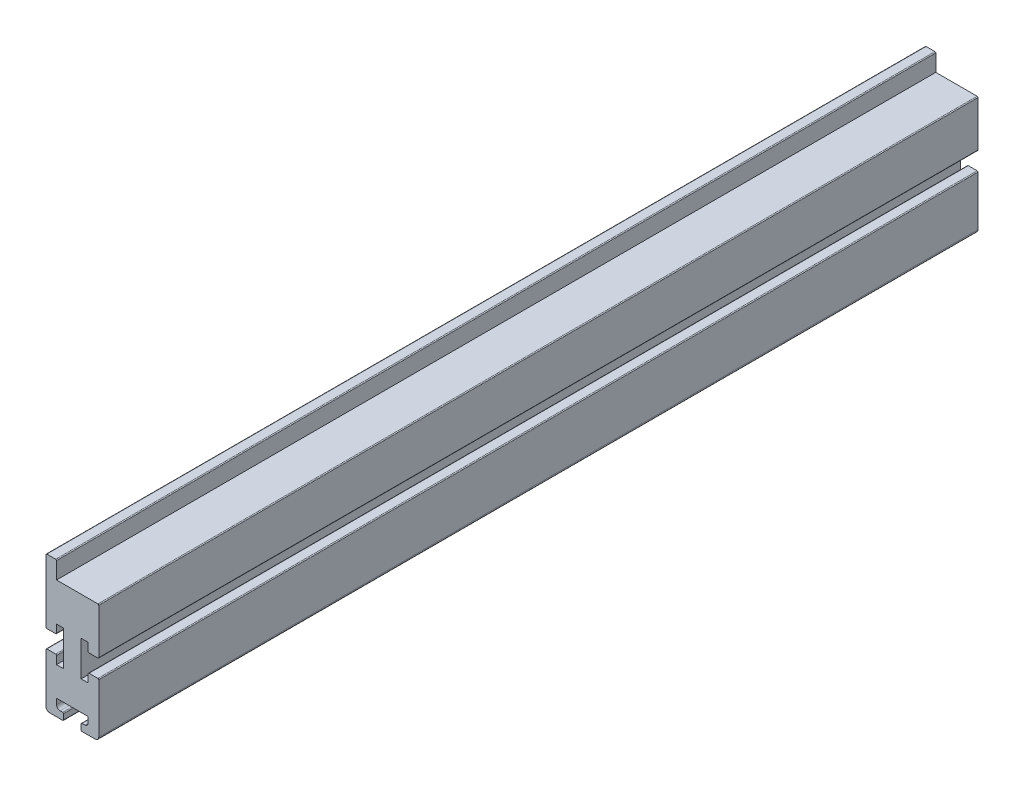
from build123d import *

# Parameters (mm, degrees)
SALIENTE_EXTRUIR1_DEPTH = 500
REDONDEO1_R             = 2
REDONDEO2_R             = 2
REDONDEO4_R             = 0.5


with BuildPart() as part:
    # Croquis1 → Saliente-Extruir1 (new body)
    with BuildSketch(Plane.XY):
        Polygon((-4.451940983, 8.315120378), (1.548059017, 8.315120378), (1.548059017, 13.315120378), (5.548059017, 13.315120378), (5.548059017, -6.684879622), (1.548059017, -6.684879622), (1.548059017, -1.684879622), (-4.451940983, -1.684879622), (-4.451940983, -32.384879622), (5.548059017, -32.384879622), (5.548059017, -28.384879622), (1.548059017, -28.384879622), (1.548059017, -23.250181803), (19.548059017, -23.250181803), (19.548059017, -28.384879622), (15.548059017, -28.384879622), (15.548059017, -32.384879622), (25.548059017, -32.384879622), (25.548059017, -1.684879622), (19.548059017, -1.684879622), (19.548059017, -6.684879622), (15.548059017, -6.684879622), (15.548059017, 13.315120378), (19.548059017, 13.315120378), (19.548059017, 8.315120378), (25.548059017, 8.315120378), (25.548059017, 35.015120378), (1.548059017, 35.015120378), (1.548059017, 45.015120378), (-4.451940983, 45.015120378), align=None)
    extrude(amount=SALIENTE_EXTRUIR1_DEPTH)

    # Redondeo1
    redondeo1_edges = [part.edges().sort_by_distance(p)[0] for p in [
        (25.548059017, -32.384879622, 250),
        (-4.451940983, -32.384879622, 250),
    ]]
    fillet(redondeo1_edges, radius=REDONDEO1_R)

    # Redondeo2
    redondeo2_edges = [part.edges().sort_by_distance(p)[0] for p in [
        (19.548059017, -28.384879622, 250),
        (1.548059017, -28.384879622, 250),
    ]]
    fillet(redondeo2_edges, radius=REDONDEO2_R)

    # Redondeo4
    redondeo4_edges = [part.edges().sort_by_distance(p)[0] for p in [
        (19.548059017, -1.684879622, 250),
        (25.548059017, -1.684879622, 250),
        (15.548059017, -32.384879622, 250),
        (15.548059017, -28.384879622, 250),
        (5.548059017, -28.384879622, 250),
        (5.548059017, -32.384879622, 250),
        (-4.451940983, -1.684879622, 250),
        (1.548059017, -1.684879622, 250),
        (1.548059017, 8.315120378, 250),
        (-4.451940983, 8.315120378, 250),
        (-4.451940983, 45.015120378, 250),
        (1.548059017, 45.015120378, 250),
        (25.548059017, 35.015120378, 250),
        (25.548059017, 8.315120378, 250),
        (19.548059017, 8.315120378, 250),
    ]]
    fillet(redondeo4_edges, radius=REDONDEO4_R)


solid = part.part
